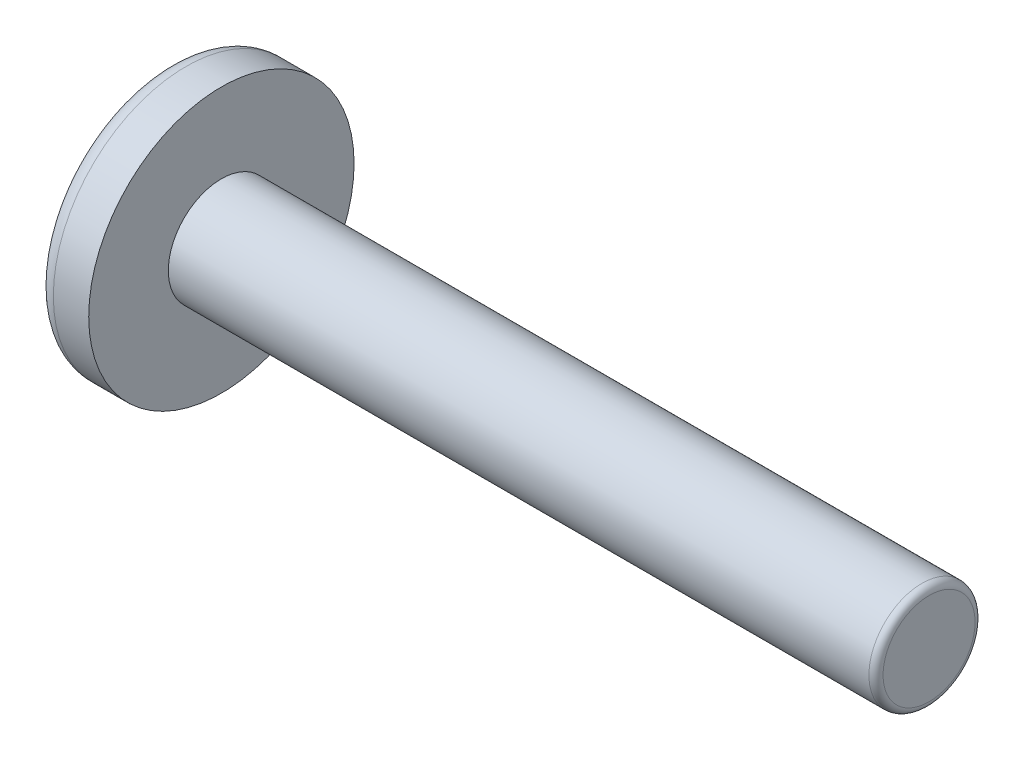
from build123d import *

# Parameters (mm, degrees)
SKETCH1_R           = 1.5
BOSS_EXTRUDE1_DEPTH = 20
SKETCH2_R           = 3.75
BOSS_EXTRUDE2_DEPTH = 1.5
FILLET1_R           = 0.5
FILLET2_R           = 0.2


with BuildPart() as part:
    # Sketch1 → Boss-Extrude1 (new body)
    with BuildSketch(Plane(origin=(0, 0, 0), x_dir=(0, 0, -1), z_dir=(1, 0, 0))):
        Circle(SKETCH1_R)
    extrude(amount=BOSS_EXTRUDE1_DEPTH)

    # Sketch2 → Boss-Extrude2 (add)
    with BuildSketch(Plane.ZY):
        Circle(SKETCH2_R)
    extrude(amount=BOSS_EXTRUDE2_DEPTH)

    # Fillet1
    fillet1_edges = [part.edges().sort_by_distance(p)[0] for p in [
        (-1.5, 0, -3.75),
    ]]
    fillet(fillet1_edges, radius=FILLET1_R)

    # Fillet2
    fillet2_edges = [part.edges().sort_by_distance(p)[0] for p in [
        (20, 0, 1.5),
    ]]
    fillet(fillet2_edges, radius=FILLET2_R)


solid = part.part
